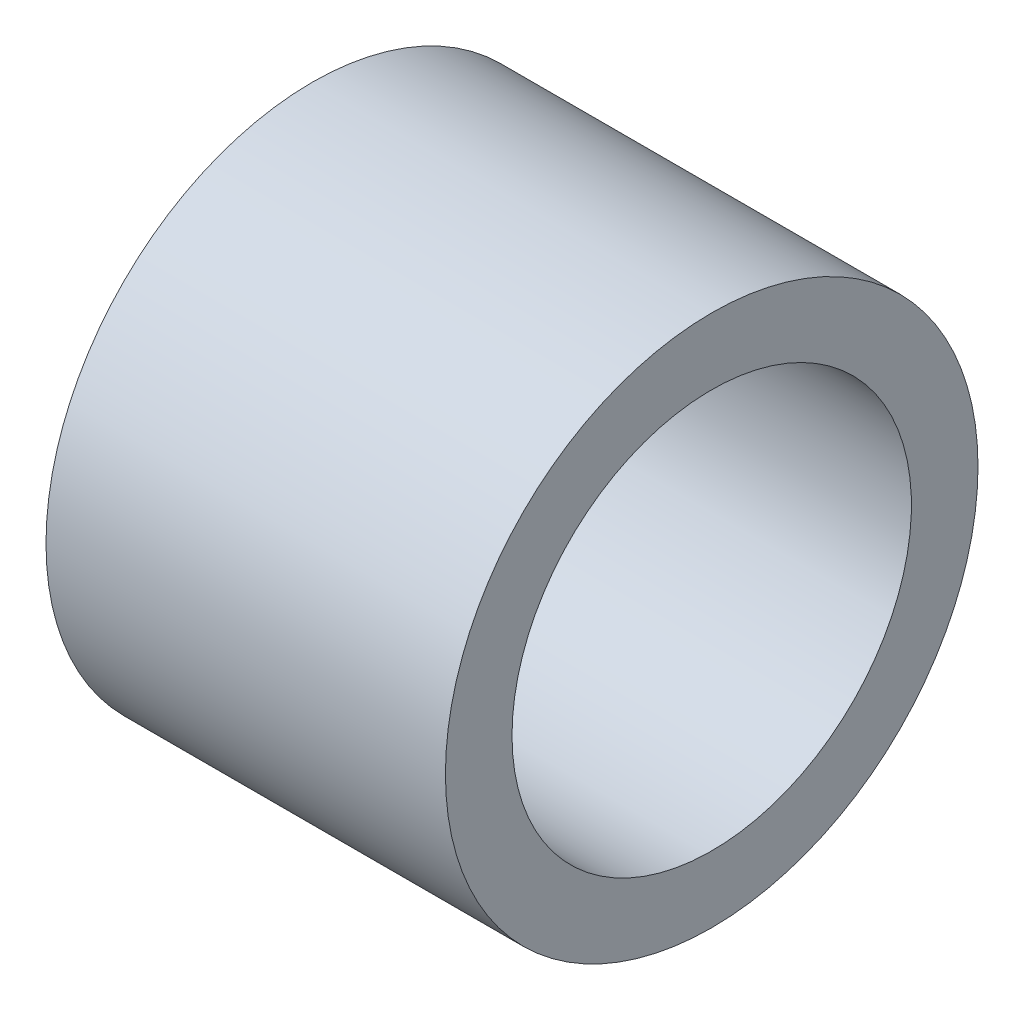
from build123d import *

# Parameters (mm, degrees)
SKETCH1_W = 6
SKETCH1_H = 1


with BuildPart() as part:
    # Sketch1 → Revolve1 (revolve)
    with BuildSketch(Plane.XY, mode=Mode.PRIVATE) as revolve1_sk:
        with Locations((3, 3.5)):
            Rectangle(SKETCH1_W, SKETCH1_H)
    revolve(revolve1_sk.sketch.rotate(Axis((0, 0, 0), (1, 0, 0)), 90), axis=Axis((0, 0, 0), (1, 0, 0)))


solid = part.part
